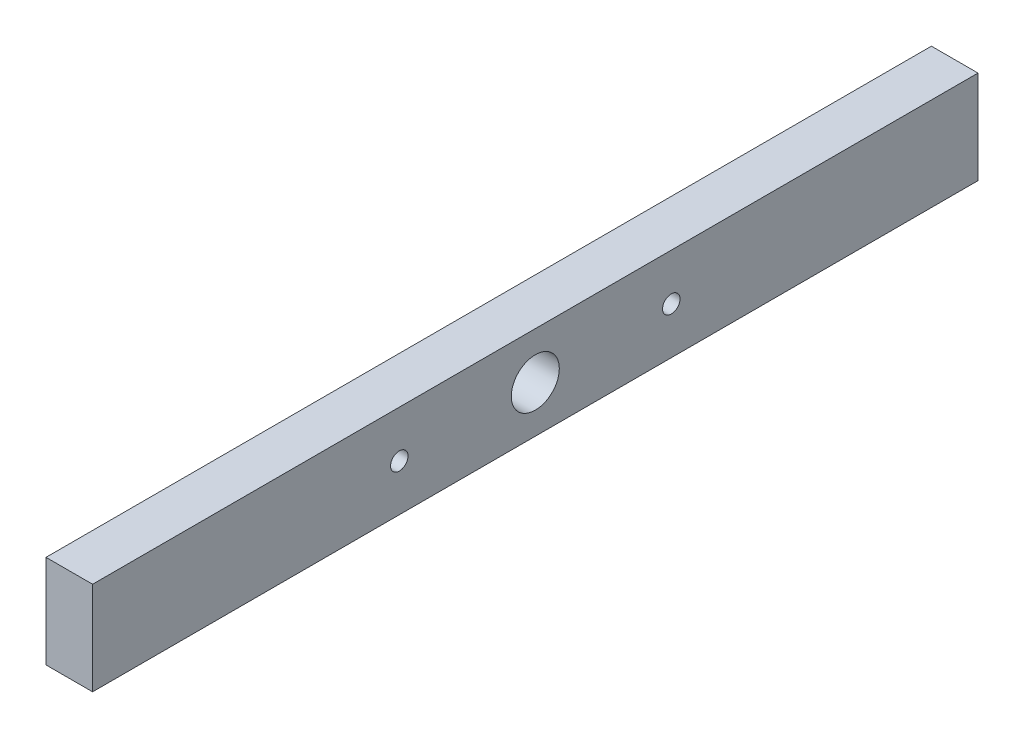
from build123d import *

# Parameters (mm, degrees)
SKETCH2_W           = 380
SKETCH2_H           = 40
SKETCH2_R           = 10.301688299
SKETCH2_R_2         = 3.75
BOSS_EXTRUDE2_DEPTH = 20


with BuildPart() as part:
    # Sketch2 → Boss-Extrude2 (new body)
    with BuildSketch(Plane(origin=(0, 0, 0), x_dir=(0, 0, -1), z_dir=(1, 0, 0))):
        with Locations((190, 20)):
            Rectangle(SKETCH2_W, SKETCH2_H)
        with Locations((190, 20)):
            Circle(SKETCH2_R, mode=Mode.SUBTRACT)
        with Locations((131.63, 20)):
            Circle(SKETCH2_R_2, mode=Mode.SUBTRACT)
        with Locations((248.37, 20)):
            Circle(SKETCH2_R_2, mode=Mode.SUBTRACT)
    extrude(amount=BOSS_EXTRUDE2_DEPTH)


solid = part.part
